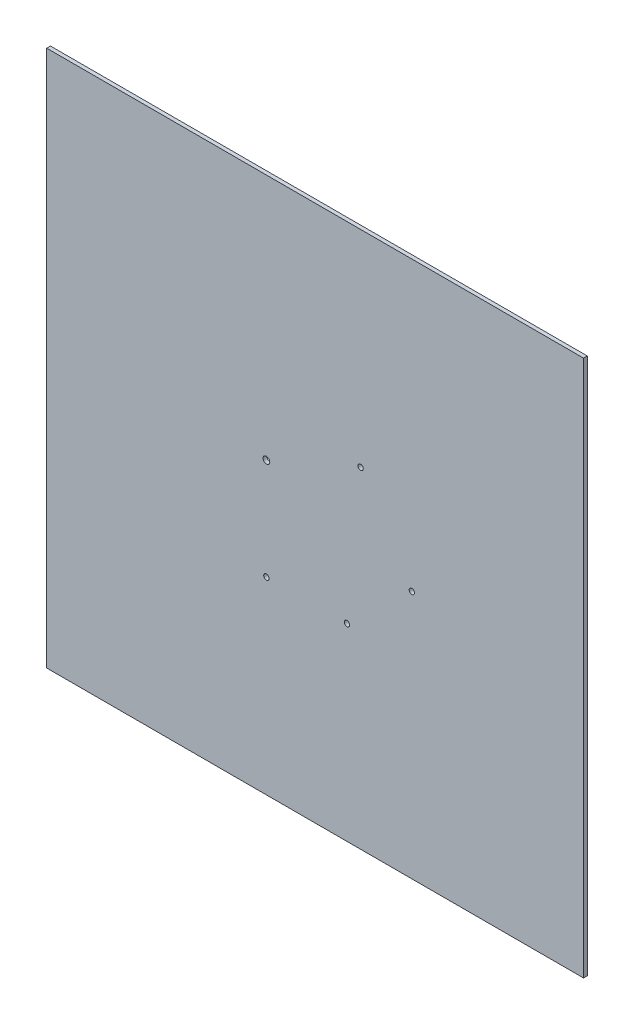
from build123d import *

# Parameters (mm, degrees)
SKETCH2_W           = 635
SKETCH2_H           = 635
BOSS_EXTRUDE3_DEPTH = 4.445
SKETCH3_R           = 3.175
SKETCH3_R_2         = 3.9751
CUT_EXTRUDE1_DEPTH  = 514.410627343


with BuildPart() as part:
    # Sketch2 → Boss-Extrude3 (new body)
    with BuildSketch(Plane.XY):
        with Locations((84.381748098, -1.971086)):
            Rectangle(SKETCH2_W, SKETCH2_H)
    extrude(amount=BOSS_EXTRUDE3_DEPTH)

    # Sketch3 → Cut-Extrude1 (cut, through all)
    with BuildSketch(Plane(origin=(0, 0, 0), x_dir=(-1, 0, 0), z_dir=(0, 0, -1))):
        with Locations((-138.143199548, 71.871365193)):
            Circle(SKETCH3_R)
        with Locations((-198.809547248, -25.000118004)):
            Circle(SKETCH3_R)
        with Locations((-122.004659563, -96.265887155)):
            Circle(SKETCH3_R)
        with Locations((-26.754659563, -96.265887155)):
            Circle(SKETCH3_R)
        with Locations((-26.754659563, 23.469712845)):
            Circle(SKETCH3_R_2)
    extrude(amount=-CUT_EXTRUDE1_DEPTH, mode=Mode.SUBTRACT)


solid = part.part
